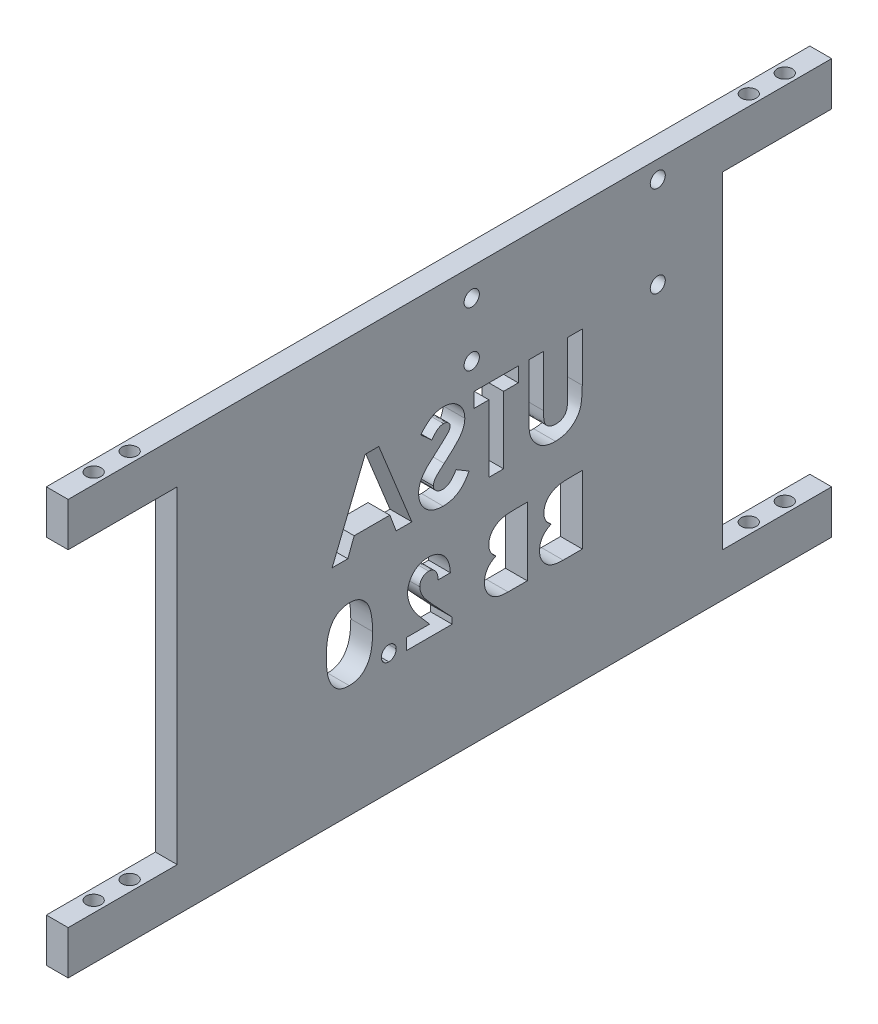
from build123d import *

# Parameters (mm, degrees)
BOSS_EXTRUDE1_DEPTH     = 5.08
CUT_EXTRUDE7_DEPTH      = 22.86
CUT_EXTRUDE8_DEPTH      = 37.084
CUT_EXTRUDE9_DEPTH      = 119.38
CUT_EXTRUDE9_DEPTH_BACK = 119.38
SKETCH10_R              = 1.7526
SKETCH11_R              = 1.7526
CUT_EXTRUDE10_DEPTH     = 12.954
SKETCH12_R              = 1.778
CUT_EXTRUDE11_DEPTH     = 28.194
CUT_EXTRUDE12_DEPTH     = 46.482


with BuildPart() as part:
    # Sketch1 → Boss-Extrude1 (new body)
    with BuildSketch(Plane(origin=(0, 0, 0), x_dir=(0, 0, -1), z_dir=(1, 0, 0))):
        Polygon((62.997029703, 20.37029703), (88.397029703, 20.37029703), (88.397029703, 10.21029703), (-89.402970297, 10.21029703), (-89.402970297, 20.37029703), (-64.002970297, 20.37029703), (-64.002970297, 96.57029703), (-89.402970297, 96.57029703), (-89.402970297, 106.73029703), (88.397029703, 106.73029703), (88.397029703, 96.57029703), (62.997029703, 96.57029703), align=None)
    extrude(amount=BOSS_EXTRUDE1_DEPTH)

    # Sketch6 → Cut-Extrude7 (cut)
    # profile 1 of 4: a face of its own
    with BuildSketch(Plane(origin=(0, 0, 0), x_dir=(0, 0, -1), z_dir=(1, 0, 0))):
        with BuildLine():
            Line((30.31895278, 81.243055873), (26.899722011, 81.243055873))
            Line((26.899722011, 81.243055873), (26.899722011, 68.848344335))
            add(Edge.make_bspline(
                [(26.899722011, 68.848344335), (26.89953609, 68.719841341), (26.899176985, 68.471639138), (26.881200037, 68.115550237), (26.864749889, 67.788229981), (26.835069153, 67.490036714), (26.791220533, 67.220842881), (26.748760761, 66.978919274), (26.691295658, 66.768597264), (26.604934795, 66.529195753), (26.471881056, 66.260215079), (26.254478628, 65.97987725), (26.003614824, 65.724028292), (25.702940107, 65.511069312), (25.365008315, 65.338804693), (24.991676234, 65.211175674), (24.583470129, 65.140230885), (24.301218, 65.129399864), (24.155941963, 65.123825104)],
                knots=[0, 0, 0, 0, 1.155499968, 2.231836252, 3.205919964, 4.102923608, 4.924856345, 5.658536265, 6.31071849, 6.882491295, 7.94666036, 8.992281882, 10.060072772, 11.158554251, 12.289267114, 13.461410017, 14.693379945, 16, 16, 16, 16], degree=3))
            add(Edge.make_bspline(
                [(24.155941963, 65.123825104), (24.001604101, 65.128328794), (23.700671401, 65.137110228), (23.267827619, 65.223309508), (22.8667954, 65.360568282), (22.506065965, 65.556471534), (22.185998296, 65.791295914), (21.915067721, 66.059069295), (21.701250307, 66.36032575), (21.561892071, 66.63825777), (21.483649284, 66.894069992), (21.425002418, 67.122628505), (21.382007777, 67.392304926), (21.343001626, 67.698887677), (21.319561934, 68.045552365), (21.294145409, 68.429511066), (21.284830017, 68.853390929), (21.283242276, 69.148546434), (21.282414318, 69.302460921)],
                knots=[0, 0, 0, 0, 1.261321664, 2.459363699, 3.594844139, 4.716940403, 5.803436589, 6.833651888, 7.818396249, 8.814403945, 9.360733334, 10.004355033, 10.743453831, 11.592799886, 12.532235708, 13.585170094, 14.740740724, 16, 16, 16, 16], degree=3))
            Line((21.282414318, 69.302460921), (21.282414318, 81.243055873))
            Line((21.282414318, 81.243055873), (17.863183549, 81.243055873))
            Line((17.863183549, 81.243055873), (17.863183549, 69.878692892))
            add(Edge.make_bspline(
                [(17.863183549, 69.878692892), (17.863658371, 69.648451442), (17.864571409, 69.205719586), (17.878592905, 68.569482754), (17.908442135, 67.988382465), (17.933512045, 67.462248923), (17.982030906, 66.991790916), (18.032576177, 66.574999455), (18.097000474, 66.213351555), (18.192859954, 65.80165937), (18.358285037, 65.327610896), (18.624971959, 64.781764629), (18.963513746, 64.247348069), (19.363653219, 63.730240169), (19.815447286, 63.249863594), (20.308878705, 62.82815514), (20.836108077, 62.471435263), (21.402644573, 62.188426193), (22.00800604, 61.967700453), (22.658182078, 61.819383873), (23.352729318, 61.71917933), (23.832466225, 61.709553451), (24.079619847, 61.704594335)],
                knots=[0, 0, 0, 0, 1.170808336, 2.251350247, 3.235597562, 4.129743112, 4.929140599, 5.639994148, 6.264258765, 6.79612947, 7.788252245, 8.809469599, 9.879094798, 10.999557536, 12.129761673, 13.226370002, 14.293821979, 15.358369427, 16.438775801, 17.562147481, 18.744053101, 20, 20, 20, 20], degree=3))
            add(Edge.make_bspline(
                [(24.079619847, 61.704594335), (24.243833631, 61.707360299), (24.567824057, 61.71281749), (25.044308816, 61.760935658), (25.504924935, 61.831843745), (25.948806921, 61.935291342), (26.377495403, 62.068926315), (26.790876491, 62.233421661), (27.187413959, 62.427859845), (27.56488884, 62.650452457), (27.922836619, 62.891148048), (28.249982412, 63.157969243), (28.557584074, 63.431183607), (28.836755121, 63.722289159), (29.089592376, 64.028229789), (29.31557512, 64.349698858), (29.51436762, 64.686667812), (29.690970389, 65.045210496), (29.842125124, 65.44355034), (29.969554244, 65.895856458), (30.080879321, 66.409218295), (30.16360955, 66.984792429), (30.238613261, 67.620681831), (30.286086475, 68.318543091), (30.310921851, 69.07839623), (30.316208161, 69.605186659), (30.31895278, 69.878692892)],
                knots=[0, 0, 0, 0, 1.001158378, 1.975264943, 2.917723546, 3.841610987, 4.75185031, 5.653588123, 6.552117133, 7.442167995, 8.324307438, 9.179605724, 10.014504199, 10.831958861, 11.636465792, 12.43274043, 13.225645099, 14.020104002, 14.867201867, 15.819789774, 16.883317127, 18.068162734, 19.364263498, 20.787406516, 22.332041935, 24, 24, 24, 24], degree=3))
            Line((30.31895278, 69.878692892), (30.31895278, 81.243055873))
        make_face()
    # profile 2 of 4: a face of its own
    with BuildSketch(Plane(origin=(0, 0, 0), x_dir=(0, 0, -1), z_dir=(1, 0, 0))):
        Polygon((15.420875857, 81.243055873), (5.163183549, 81.243055873), (5.163183549, 77.823825104), (8.582414318, 77.823825104), (8.582414318, 62.193055873), (12.001645088, 62.193055873), (12.001645088, 77.823825104), (15.420875857, 77.823825104), align=None)
    # profile 3 of 4: a face of its own
    with BuildSketch(Plane(origin=(0, 0, 0), x_dir=(0, 0, -1), z_dir=(1, 0, 0))):
        with BuildLine():
            Line((-7.292585682, 78.697713325), (-4.735794816, 76.358440488))
            add(Edge.make_bspline(
                [(-4.735794816, 76.358440488), (-4.626272859, 76.512932595), (-4.416005974, 76.809535896), (-4.075185285, 77.206694706), (-3.735903576, 77.545500728), (-3.395017609, 77.824538585), (-3.0495059, 78.042112916), (-2.699968206, 78.196157946), (-2.348386155, 78.294085834), (-2.112177289, 78.306280212), (-1.995830874, 78.312286642)],
                knots=[0, 0, 0, 0, 1.299362458, 2.494594718, 3.587462134, 4.587049575, 5.512617175, 6.380583204, 7.202344345, 8, 8, 8, 8], degree=3))
            add(Edge.make_bspline(
                [(-1.995830874, 78.312286642), (-1.887306276, 78.308480692), (-1.677773789, 78.301132403), (-1.379069684, 78.228090953), (-1.113875926, 78.102032137), (-0.882451332, 77.937199631), (-0.69912891, 77.738614675), (-0.552760172, 77.530350117), (-0.470342273, 77.300473144), (-0.459494456, 77.142584367), (-0.454124143, 77.064420056)],
                knots=[0, 0, 0, 0, 1.185010067, 2.2879431, 3.333075148, 4.379039566, 5.372662701, 6.27520591, 7.14612461, 8, 8, 8, 8], degree=3))
            add(Edge.make_bspline(
                [(-0.454124143, 77.064420056), (-0.457489446, 76.985128581), (-0.464266698, 76.825446569), (-0.529725731, 76.591412694), (-0.628391183, 76.362734355), (-0.722670052, 76.223526968), (-0.770860922, 76.152370777)],
                knots=[0, 0, 0, 0, 0.967525499, 1.948461899, 2.951351359, 4, 4, 4, 4], degree=3))
            add(Edge.make_bspline(
                [(-0.770860922, 76.152370777), (-0.814671636, 76.097061814), (-0.915518115, 75.969747887), (-1.107811695, 75.768102471), (-1.349292047, 75.521069187), (-1.649251842, 75.237142784), (-1.995238925, 74.90611216), (-2.403290244, 74.540990253), (-2.861660303, 74.130469664), (-3.187459121, 73.844597991), (-3.358180634, 73.694798662)],
                knots=[0, 0, 0, 0, 0.473873513, 1.090794244, 1.870441696, 2.795289791, 3.865433203, 5.087734844, 6.473946851, 8, 8, 8, 8], degree=3))
            add(Edge.make_bspline(
                [(-3.358180634, 73.694798662), (-3.518427331, 73.556113228), (-3.822542271, 73.292917087), (-4.255237438, 72.919352425), (-4.635504425, 72.583265406), (-4.968882855, 72.289699979), (-5.250319035, 72.03557597), (-5.480996125, 71.819678669), (-5.663731453, 71.6462112), (-5.767605788, 71.541436743), (-5.811936643, 71.496721738)],
                knots=[0, 0, 0, 0, 1.543621617, 2.929473131, 4.163658386, 5.240097082, 6.164993805, 6.925417477, 7.541396219, 8, 8, 8, 8], degree=3))
            add(Edge.make_bspline(
                [(-5.811936643, 71.496721738), (-5.980118667, 71.314712769), (-6.30342358, 70.964827611), (-6.723605995, 70.422615653), (-7.069429714, 69.893306223), (-7.336965501, 69.366939505), (-7.539019287, 68.835921075), (-7.681469883, 68.287227735), (-7.766784493, 67.715125983), (-7.776256407, 67.324736378), (-7.78104722, 67.127280633)],
                knots=[0, 0, 0, 0, 1.206664779, 2.319633467, 3.337109185, 4.282041471, 5.190008762, 6.099243693, 7.03861361, 8, 8, 8, 8], degree=3))
            add(Edge.make_bspline(
                [(-7.78104722, 67.127280633), (-7.777637242, 66.934884225), (-7.770946737, 66.557395311), (-7.689000889, 66.004996516), (-7.572150919, 65.476326894), (-7.391480367, 64.977139119), (-7.171280167, 64.499239175), (-6.895227414, 64.050071225), (-6.571041308, 63.625089504), (-6.199474253, 63.231891081), (-5.78847697, 62.875090766), (-5.347643323, 62.557458698), (-4.872662619, 62.295212966), (-4.367593019, 62.079272313), (-3.832704874, 61.912951934), (-3.268635398, 61.790025673), (-2.674521808, 61.716247268), (-2.268258374, 61.708534612), (-2.060704672, 61.704594335)],
                knots=[0, 0, 0, 0, 1.043214005, 2.046824704, 3.02475056, 3.976699089, 4.921714032, 5.875962561, 6.831408892, 7.817874052, 8.806269674, 9.781291748, 10.760897367, 11.74438705, 12.757449933, 13.795994037, 14.874007457, 16, 16, 16, 16], degree=3))
            add(Edge.make_bspline(
                [(-2.060704672, 61.704594335), (-1.897776783, 61.707484784), (-1.575086124, 61.713209531), (-1.099488878, 61.759947328), (-0.640245974, 61.835377158), (-0.197874707, 61.943490638), (0.229617882, 62.080485081), (0.642249351, 62.247818544), (1.037171168, 62.448084635), (1.417371497, 62.677165085), (1.781002097, 62.943157664), (2.132660932, 63.240624239), (2.468854995, 63.57413998), (2.791198956, 63.942916134), (3.09763037, 64.347996988), (3.398179835, 64.783741041), (3.679490029, 65.258235111), (3.85326785, 65.591096539), (3.942029703, 65.761114767)],
                knots=[0, 0, 0, 0, 1.016823716, 2.013894106, 2.979844003, 3.91962641, 4.853723003, 5.779685073, 6.695824784, 7.614987388, 8.547259901, 9.504950863, 10.487499108, 11.500346958, 12.559593716, 13.656357062, 14.802919212, 16, 16, 16, 16], degree=3))
            Line((3.942029703, 65.761114767), (0.934938357, 67.566132796))
            add(Edge.make_bspline(
                [(0.934938357, 67.566132796), (0.823910545, 67.373139892), (0.61106074, 67.003156002), (0.250366846, 66.506035752), (-0.119145633, 66.080334547), (-0.506019497, 65.733576682), (-0.905550503, 65.46112556), (-1.319668479, 65.266413086), (-1.748664376, 65.145886285), (-2.040876893, 65.131167179), (-2.186636162, 65.123825104)],
                knots=[0, 0, 0, 0, 1.283663364, 2.460892379, 3.537111102, 4.529833553, 5.449777664, 6.316464042, 7.160231139, 8, 8, 8, 8], degree=3))
            add(Edge.make_bspline(
                [(-2.186636162, 65.123825104), (-2.334894208, 65.12982104), (-2.622536408, 65.14145403), (-3.033108841, 65.248904451), (-3.409537193, 65.417609494), (-3.734919081, 65.658328327), (-4.010431948, 65.936154447), (-4.213776259, 66.245248708), (-4.341518526, 66.579681238), (-4.355023981, 66.812000072), (-4.361816451, 66.928843133)],
                knots=[0, 0, 0, 0, 1.13588714, 2.203786484, 3.234766741, 4.283437687, 5.291419208, 6.222934724, 7.106237994, 8, 8, 8, 8], degree=3))
            add(Edge.make_bspline(
                [(-4.361816451, 66.928843133), (-4.355543883, 67.037546587), (-4.342801762, 67.258367249), (-4.248947224, 67.586692063), (-4.102223955, 67.914867563), (-3.928639981, 68.184045987), (-3.751996551, 68.409421784), (-3.583085591, 68.604699717), (-3.377396724, 68.820447646), (-3.135451485, 69.056936966), (-2.860446604, 69.316249552), (-2.552150424, 69.598360011), (-2.207032628, 69.900783288), (-1.963102689, 70.106791036), (-1.835554432, 70.2145102)],
                knots=[0, 0, 0, 0, 0.916159276, 1.861089862, 2.860218735, 3.940849679, 4.552606315, 5.27541173, 6.11797699, 7.06649574, 8.129236253, 9.306560635, 10.591630461, 12, 12, 12, 12], degree=3))
            add(Edge.make_bspline(
                [(-1.835554432, 70.2145102), (-1.593080119, 70.41966672), (-1.12769852, 70.813424179), (-0.470055278, 71.39499155), (0.122540168, 71.938519547), (0.644969527, 72.450727363), (1.103889357, 72.922155708), (1.496191654, 73.356633703), (1.817566798, 73.757512752), (2.15574484, 74.232327158), (2.477081594, 74.810921138), (2.754807737, 75.50703677), (2.934984737, 76.203064075), (2.955171064, 76.670338471), (2.965106626, 76.900327508)],
                knots=[0, 0, 0, 0, 1.345494975, 2.582412109, 3.71882943, 4.751509156, 5.681369928, 6.505683931, 7.230279997, 7.856715994, 8.973648664, 10.023341002, 11.027102913, 12, 12, 12, 12], degree=3))
            add(Edge.make_bspline(
                [(2.965106626, 76.900327508), (2.960974439, 77.063423388), (2.952833586, 77.384739792), (2.880215926, 77.857188747), (2.771686067, 78.313062291), (2.614069552, 78.750697192), (2.409502348, 79.169545292), (2.161063425, 79.57165703), (1.864894996, 79.95333146), (1.531133172, 80.31431556), (1.163413094, 80.644213947), (0.77045746, 80.935382329), (0.354490434, 81.181307379), (-0.081943308, 81.385320065), (-0.541548166, 81.541478816), (-1.02093825, 81.652171922), (-1.520801159, 81.718008652), (-1.86079712, 81.726958391), (-2.033991932, 81.731517412)],
                knots=[0, 0, 0, 0, 1.010766082, 1.991317756, 2.957454644, 3.913069143, 4.869106762, 5.843196583, 6.838735724, 7.860187025, 8.887984031, 9.89767229, 10.887916223, 11.879572884, 12.879850636, 13.892031539, 14.926195476, 16, 16, 16, 16], degree=3))
            add(Edge.make_bspline(
                [(-2.033991932, 81.731517412), (-2.258443836, 81.723306483), (-2.705575899, 81.706949439), (-3.36667355, 81.579042704), (-4.012406096, 81.37789589), (-4.532749483, 81.135234389), (-4.946777003, 80.900168078), (-5.264090422, 80.683748629), (-5.586973906, 80.435828519), (-5.918031309, 80.155626486), (-6.251111073, 79.837863155), (-6.595684247, 79.490103133), (-6.947055602, 79.109340959), (-7.175391272, 78.837326228), (-7.292585682, 78.697713325)],
                knots=[0, 0, 0, 0, 1.282922637, 2.555718331, 3.837320111, 5.142675274, 5.830281639, 6.55870424, 7.337177975, 8.157850921, 9.037902056, 9.96903443, 10.957596896, 12, 12, 12, 12], degree=3))
        make_face()
    # profile 4 of 4: a face of its own
    with BuildSketch(Plane(origin=(0, 0, 0), x_dir=(0, 0, -1), z_dir=(1, 0, 0))):
        Polygon((-17.065632557, 81.243055873), (-20.236816451, 81.243055873), (-27.930085682, 62.193055873), (-24.27807246, 62.193055873), (-22.797423422, 66.100748181), (-14.497393374, 66.100748181), (-13.016744335, 62.193055873), (-9.36854722, 62.193055873), align=None)
        Polygon((-18.649316451, 76.133290248), (-15.794869335, 69.51997895), (-21.503763566, 69.51997895), align=None, mode=Mode.SUBTRACT)
    extrude(amount=CUT_EXTRUDE7_DEPTH, mode=Mode.SUBTRACT)


with BuildPart() as cut_extrude7_piece_1:
    # of the separate pieces the step leaves, piece 1, a body of its own (cut_extrude7_pieces)
    add(part.part.solids().sort_by_distance((0, 20.37029703, -62.997029703))[0])

    # Sketch7 → Cut-Extrude8 (cut)
    # profile 1 of 5: a face of its own
    with BuildSketch(Plane(origin=(0, 0, 0), x_dir=(0, 0, -1), z_dir=(1, 0, 0))):
        with BuildLine():
            Line((30.33932928, 36.846029673), (30.33932928, 52.721029673))
            Line((30.33932928, 52.721029673), (27.795258767, 52.721029673))
            add(Edge.make_bspline(
                [(27.795258767, 52.721029673), (27.617157924, 52.721049999), (27.272536169, 52.721089329), (26.775336914, 52.703629323), (26.314226595, 52.68104285), (25.890672644, 52.655773839), (25.503954142, 52.612230284), (25.154659157, 52.566340134), (24.842089797, 52.510999441), (24.648845147, 52.461357125), (24.55792904, 52.438001829)],
                knots=[0, 0, 0, 0, 1.311965854, 2.538629056, 3.664479157, 4.713267157, 5.663616078, 6.530575999, 7.308677837, 8, 8, 8, 8], degree=3))
            add(Edge.make_bspline(
                [(24.55792904, 52.438001829), (24.438546961, 52.405058767), (24.204280996, 52.340413904), (23.868737375, 52.209860809), (23.550427446, 52.064741789), (23.249739854, 51.899188128), (22.968520943, 51.71120113), (22.707839439, 51.499288874), (22.462073088, 51.271957508), (22.239948491, 51.022871373), (22.039184454, 50.75966573), (21.864756501, 50.482409546), (21.713200966, 50.195342251), (21.591916841, 49.894851292), (21.500531531, 49.582320513), (21.433692697, 49.259084467), (21.390372081, 48.924120356), (21.386278852, 48.696233324), (21.384201075, 48.580554914)],
                knots=[0, 0, 0, 0, 1.099996261, 2.158545794, 3.195537121, 4.207578794, 5.205712374, 6.197378256, 7.190519799, 8.17788031, 9.159561366, 10.129234751, 11.085776129, 12.040971148, 13.00380137, 13.975669004, 14.972423361, 16, 16, 16, 16], degree=3))
            add(Edge.make_bspline(
                [(21.384201075, 48.580554914), (21.389633843, 48.43193852), (21.400327581, 48.139405411), (21.468639902, 47.709727197), (21.596736147, 47.303619527), (21.764346969, 46.913597988), (21.992245284, 46.541117364), (22.281632069, 46.186354758), (22.627820205, 45.838386499), (22.893365616, 45.629803), (23.031486732, 45.521310122)],
                knots=[0, 0, 0, 0, 0.986156485, 1.941127874, 2.875419072, 3.804401753, 4.751181392, 5.761612777, 6.835722519, 8, 8, 8, 8], degree=3))
            add(Edge.make_bspline(
                [(23.031486732, 45.521310122), (22.919560006, 45.464172499), (22.700102661, 45.352141428), (22.388537705, 45.16799579), (22.100062566, 44.97213355), (21.833383808, 44.768495534), (21.594095324, 44.548449232), (21.372316491, 44.324674014), (21.178988725, 44.084348491), (21.00610921, 43.836038322), (20.855845145, 43.576147947), (20.724981714, 43.305116262), (20.614446068, 43.022017364), (20.520841624, 42.728291997), (20.451031405, 42.422929884), (20.405513658, 42.105821813), (20.370662425, 41.778049286), (20.367951327, 41.554778825), (20.36657287, 41.441257037)],
                knots=[0, 0, 0, 0, 1.164658916, 2.283573913, 3.35186032, 4.395461096, 5.390182219, 6.362969632, 7.312859996, 8.245001507, 9.165155236, 10.092416118, 11.032087915, 11.979892451, 12.947605196, 13.931445124, 14.948243989, 16, 16, 16, 16], degree=3))
            add(Edge.make_bspline(
                [(20.36657287, 41.441257037), (20.375518135, 41.224436912), (20.393171579, 40.796543265), (20.522244948, 40.168297118), (20.746017158, 39.572662789), (21.046497092, 39.012007584), (21.416746184, 38.50256155), (21.842426464, 38.056291247), (22.319252308, 37.678533343), (22.759181781, 37.423576064), (23.139686131, 37.252475887), (23.454850775, 37.146690968), (23.793330921, 37.048691979), (24.161326715, 36.979875066), (24.552166893, 36.91688626), (24.969662172, 36.877995666), (25.413032261, 36.851640468), (25.717558004, 36.84793775), (25.87448553, 36.846029673)],
                knots=[0, 0, 0, 0, 1.284142165, 2.534249414, 3.780121997, 5.041676246, 6.291546858, 7.49970053, 8.684500223, 9.883330709, 10.50184324, 11.153274765, 11.851151195, 12.587658647, 13.369265475, 14.195992086, 15.070362669, 16, 16, 16, 16], degree=3))
            Line((25.87448553, 36.846029673), (30.33932928, 36.846029673))
        make_face()
        with BuildLine():
            Line((27.489970306, 49.871670699), (27.489970306, 46.411734801))
            Line((27.489970306, 46.411734801), (26.733109328, 46.411734801))
            add(Edge.make_bspline(
                [(26.733109328, 46.411734801), (26.630245121, 46.412631816), (26.431671995, 46.414363449), (26.144854177, 46.436666278), (25.878159926, 46.47471629), (25.632600756, 46.527805628), (25.405889192, 46.595221347), (25.199473536, 46.676336976), (25.014261357, 46.77530686), (24.799087644, 46.922726869), (24.571633511, 47.139662013), (24.371408196, 47.453069775), (24.253476823, 47.81348751), (24.240342449, 48.067682003), (24.233560049, 48.198944337)],
                knots=[0, 0, 0, 0, 1.065314748, 2.056525647, 2.977365736, 3.853934255, 4.656397591, 5.425096493, 6.14721249, 6.826394842, 8.123232004, 9.372140726, 10.643011755, 12, 12, 12, 12], degree=3))
            add(Edge.make_bspline(
                [(24.233560049, 48.198944337), (24.238987211, 48.321893321), (24.249480409, 48.559610241), (24.368222139, 48.893385968), (24.552651521, 49.189179573), (24.770396329, 49.391626105), (24.975445377, 49.529891119), (25.151020954, 49.620932742), (25.343728335, 49.702432273), (25.557298127, 49.7647488), (25.79051073, 49.811508929), (26.042233299, 49.845848643), (26.312900144, 49.869221713), (26.499850309, 49.87083686), (26.596365538, 49.871670699)],
                knots=[0, 0, 0, 0, 1.347982417, 2.606269829, 3.849316587, 5.153353503, 5.842674298, 6.568177932, 7.326619318, 8.142485038, 9.012069166, 9.942760135, 10.937925643, 12, 12, 12, 12], degree=3))
            Line((26.596365538, 49.871670699), (27.489970306, 49.871670699))
        make_face(mode=Mode.SUBTRACT)
        with BuildLine():
            Line((27.489970306, 43.765901468), (27.489970306, 39.695388648))
            Line((27.489970306, 39.695388648), (26.669507565, 39.695388648))
            add(Edge.make_bspline(
                [(26.669507565, 39.695388648), (26.507301037, 39.696315327), (26.195438745, 39.698096985), (25.748696565, 39.719623647), (25.342496237, 39.758421662), (24.97791404, 39.806857858), (24.654391547, 39.872481327), (24.373022341, 39.955913159), (24.129947808, 40.047702706), (23.926625436, 40.161073694), (23.760522705, 40.293009411), (23.610632406, 40.427850882), (23.488421196, 40.583403259), (23.391725406, 40.752989109), (23.308035371, 40.932395796), (23.257559451, 41.128629088), (23.219128858, 41.335873101), (23.217013919, 41.479219302), (23.215931844, 41.552560122)],
                knots=[0, 0, 0, 0, 1.753078804, 3.370512758, 4.83203934, 6.162291463, 7.344201807, 8.395507345, 9.331626367, 10.147333109, 10.898971645, 11.62040215, 12.321813352, 13.025280112, 13.727906689, 14.453419512, 15.208716525, 16, 16, 16, 16], degree=3))
            add(Edge.make_bspline(
                [(23.215931844, 41.552560122), (23.21831813, 41.636426503), (23.222965972, 41.799775651), (23.260924957, 42.038527864), (23.329908832, 42.261418897), (23.416797389, 42.474148373), (23.537707431, 42.669099836), (23.681404885, 42.853019817), (23.855028093, 43.019680218), (24.050277519, 43.179161282), (24.278016644, 43.318795595), (24.538352317, 43.439953094), (24.832698821, 43.541139376), (25.161967928, 43.62170396), (25.524716146, 43.690078009), (25.923591139, 43.730904864), (26.355270937, 43.76126959), (26.654604735, 43.764322426), (26.809431444, 43.765901468)],
                knots=[0, 0, 0, 0, 0.845221588, 1.646264278, 2.427170338, 3.19324141, 3.95557735, 4.731569926, 5.540061037, 6.376114724, 7.268642756, 8.224665384, 9.265483498, 10.400594375, 11.639216012, 12.983232105, 14.439614077, 16, 16, 16, 16], degree=3))
            Line((26.809431444, 43.765901468), (27.489970306, 43.765901468))
        make_face(mode=Mode.SUBTRACT)
    # profile 2 of 5: a face of its own
    with BuildSketch(Plane(origin=(0, 0, 0), x_dir=(0, 0, -1), z_dir=(1, 0, 0))):
        with BuildLine():
            Line((17.517213896, 36.846029673), (17.517213896, 52.721029673))
            Line((17.517213896, 52.721029673), (14.973143383, 52.721029673))
            add(Edge.make_bspline(
                [(14.973143383, 52.721029673), (14.795042539, 52.721049999), (14.450420784, 52.721089329), (13.95322153, 52.703629323), (13.492111211, 52.68104285), (13.068557259, 52.655773839), (12.681838757, 52.612230284), (12.332543773, 52.566340134), (12.019974413, 52.510999441), (11.826729762, 52.461357125), (11.735813655, 52.438001829)],
                knots=[0, 0, 0, 0, 1.311965854, 2.538629056, 3.664479157, 4.713267157, 5.663616078, 6.530575999, 7.308677837, 8, 8, 8, 8], degree=3))
            add(Edge.make_bspline(
                [(11.735813655, 52.438001829), (11.616431576, 52.405058767), (11.382165611, 52.340413904), (11.046621991, 52.209860809), (10.728312061, 52.064741789), (10.427624469, 51.899188128), (10.146405558, 51.71120113), (9.885724054, 51.499288874), (9.639957703, 51.271957508), (9.417833107, 51.022871373), (9.21706907, 50.75966573), (9.042641116, 50.482409546), (8.891085581, 50.195342251), (8.769801456, 49.894851292), (8.678416147, 49.582320513), (8.611577312, 49.259084467), (8.568256697, 48.924120356), (8.564163467, 48.696233324), (8.56208569, 48.580554914)],
                knots=[0, 0, 0, 0, 1.099996261, 2.158545794, 3.195537121, 4.207578794, 5.205712374, 6.197378256, 7.190519799, 8.17788031, 9.159561366, 10.129234751, 11.085776129, 12.040971148, 13.00380137, 13.975669004, 14.972423361, 16, 16, 16, 16], degree=3))
            add(Edge.make_bspline(
                [(8.56208569, 48.580554914), (8.567518459, 48.43193852), (8.578212196, 48.139405411), (8.646524517, 47.709727197), (8.774620763, 47.303619527), (8.942231584, 46.913597988), (9.1701299, 46.541117364), (9.459516684, 46.186354758), (9.80570482, 45.838386499), (10.071250231, 45.629803), (10.209371347, 45.521310122)],
                knots=[0, 0, 0, 0, 0.986156485, 1.941127874, 2.875419072, 3.804401753, 4.751181392, 5.761612777, 6.835722519, 8, 8, 8, 8], degree=3))
            add(Edge.make_bspline(
                [(10.209371347, 45.521310122), (10.097444621, 45.464172499), (9.877987277, 45.352141428), (9.566422321, 45.16799579), (9.277947181, 44.97213355), (9.011268424, 44.768495534), (8.77197994, 44.548449232), (8.550201107, 44.324674014), (8.35687334, 44.084348491), (8.183993825, 43.836038322), (8.03372976, 43.576147947), (7.902866329, 43.305116262), (7.792330683, 43.022017364), (7.69872624, 42.728291997), (7.628916021, 42.422929884), (7.583398273, 42.105821813), (7.548547041, 41.778049286), (7.545835942, 41.554778825), (7.544457485, 41.441257037)],
                knots=[0, 0, 0, 0, 1.164658916, 2.283573913, 3.35186032, 4.395461096, 5.390182219, 6.362969632, 7.312859996, 8.245001507, 9.165155236, 10.092416118, 11.032087915, 11.979892451, 12.947605196, 13.931445124, 14.948243989, 16, 16, 16, 16], degree=3))
            add(Edge.make_bspline(
                [(7.544457485, 41.441257037), (7.55340275, 41.224436912), (7.571056194, 40.796543265), (7.700129563, 40.168297118), (7.923901773, 39.572662789), (8.224381707, 39.012007584), (8.594630799, 38.50256155), (9.020311079, 38.056291247), (9.497136923, 37.678533343), (9.937066397, 37.423576064), (10.317570746, 37.252475887), (10.63273539, 37.146690968), (10.971215537, 37.048691979), (11.33921133, 36.979875066), (11.730051508, 36.91688626), (12.147546788, 36.877995666), (12.590916877, 36.851640468), (12.89544262, 36.84793775), (13.052370146, 36.846029673)],
                knots=[0, 0, 0, 0, 1.284142165, 2.534249414, 3.780121997, 5.041676246, 6.291546858, 7.49970053, 8.684500223, 9.883330709, 10.50184324, 11.153274765, 11.851151195, 12.587658647, 13.369265475, 14.195992086, 15.070362669, 16, 16, 16, 16], degree=3))
            Line((13.052370146, 36.846029673), (17.517213896, 36.846029673))
        make_face()
        with BuildLine():
            Line((14.667854921, 49.871670699), (14.667854921, 46.411734801))
            Line((14.667854921, 46.411734801), (13.910993944, 46.411734801))
            add(Edge.make_bspline(
                [(13.910993944, 46.411734801), (13.808129737, 46.412631816), (13.609556611, 46.414363449), (13.322738793, 46.436666278), (13.056044542, 46.47471629), (12.810485371, 46.527805628), (12.583773808, 46.595221347), (12.377358151, 46.676336976), (12.192145973, 46.77530686), (11.976972259, 46.922726869), (11.749518127, 47.139662013), (11.549292812, 47.453069775), (11.431361439, 47.81348751), (11.418227064, 48.067682003), (11.411444665, 48.198944337)],
                knots=[0, 0, 0, 0, 1.065314748, 2.056525647, 2.977365736, 3.853934255, 4.656397591, 5.425096493, 6.14721249, 6.826394842, 8.123232004, 9.372140726, 10.643011755, 12, 12, 12, 12], degree=3))
            add(Edge.make_bspline(
                [(11.411444665, 48.198944337), (11.416871826, 48.321893321), (11.427365024, 48.559610241), (11.546106754, 48.893385968), (11.730536136, 49.189179573), (11.948280944, 49.391626105), (12.153329992, 49.529891119), (12.32890557, 49.620932742), (12.52161295, 49.702432273), (12.735182742, 49.7647488), (12.968395345, 49.811508929), (13.220117914, 49.845848643), (13.490784759, 49.869221713), (13.677734924, 49.87083686), (13.774250154, 49.871670699)],
                knots=[0, 0, 0, 0, 1.347982417, 2.606269829, 3.849316587, 5.153353503, 5.842674298, 6.568177932, 7.326619318, 8.142485038, 9.012069166, 9.942760135, 10.937925643, 12, 12, 12, 12], degree=3))
            Line((13.774250154, 49.871670699), (14.667854921, 49.871670699))
        make_face(mode=Mode.SUBTRACT)
        with BuildLine():
            Line((14.667854921, 43.765901468), (14.667854921, 39.695388648))
            Line((14.667854921, 39.695388648), (13.847392181, 39.695388648))
            add(Edge.make_bspline(
                [(13.847392181, 39.695388648), (13.685185652, 39.696315327), (13.373323361, 39.698096985), (12.92658118, 39.719623647), (12.520380853, 39.758421662), (12.155798656, 39.806857858), (11.832276162, 39.872481327), (11.550906956, 39.955913159), (11.307832424, 40.047702706), (11.104510051, 40.161073694), (10.938407321, 40.293009411), (10.788517021, 40.427850882), (10.666305811, 40.583403259), (10.569610021, 40.752989109), (10.485919986, 40.932395796), (10.435444066, 41.128629088), (10.397013473, 41.335873101), (10.394898534, 41.479219302), (10.39381646, 41.552560122)],
                knots=[0, 0, 0, 0, 1.753078804, 3.370512758, 4.83203934, 6.162291463, 7.344201807, 8.395507345, 9.331626367, 10.147333109, 10.898971645, 11.62040215, 12.321813352, 13.025280112, 13.727906689, 14.453419512, 15.208716525, 16, 16, 16, 16], degree=3))
            add(Edge.make_bspline(
                [(10.39381646, 41.552560122), (10.396202745, 41.636426503), (10.400850588, 41.799775651), (10.438809572, 42.038527864), (10.507793447, 42.261418897), (10.594682004, 42.474148373), (10.715592047, 42.669099836), (10.8592895, 42.853019817), (11.032912709, 43.019680218), (11.228162135, 43.179161282), (11.45590126, 43.318795595), (11.716236932, 43.439953094), (12.010583437, 43.541139376), (12.339852543, 43.62170396), (12.702600761, 43.690078009), (13.101475754, 43.730904864), (13.533155553, 43.76126959), (13.83248935, 43.764322426), (13.987316059, 43.765901468)],
                knots=[0, 0, 0, 0, 0.845221588, 1.646264278, 2.427170338, 3.19324141, 3.95557735, 4.731569926, 5.540061037, 6.376114724, 7.268642756, 8.224665384, 9.265483498, 10.400594375, 11.639216012, 12.983232105, 14.439614077, 16, 16, 16, 16], degree=3))
            Line((13.987316059, 43.765901468), (14.667854921, 43.765901468))
        make_face(mode=Mode.SUBTRACT)
    # profile 3 of 5: a face of its own
    with BuildSketch(Plane(origin=(0, 0, 0), x_dir=(0, 0, -1), z_dir=(1, 0, 0))):
        with BuildLine():
            Line((-3.242401489, 47.429363007), (-0.393042515, 47.429363007))
            add(Edge.make_bspline(
                [(-0.393042515, 47.429363007), (-0.405348459, 47.644901939), (-0.429393536, 48.066052071), (-0.525038773, 48.677786123), (-0.653200108, 49.255807534), (-0.824248424, 49.798094321), (-1.039181824, 50.304449435), (-1.29246952, 50.776599067), (-1.590582435, 51.21205734), (-1.927175746, 51.608724228), (-2.296535026, 51.964577754), (-2.690992013, 52.280099846), (-3.116580458, 52.540460735), (-3.565524512, 52.754713642), (-4.037747728, 52.925891759), (-4.537718082, 53.040338183), (-5.061106557, 53.117842422), (-5.419408351, 53.124624354), (-5.60202689, 53.128080955)],
                knots=[0, 0, 0, 0, 1.199038563, 2.342849363, 3.436047546, 4.486744587, 5.497670872, 6.488682221, 7.459191391, 8.424610317, 9.374430501, 10.305433194, 11.225809216, 12.140057399, 13.06607119, 14.010487599, 14.985989317, 16, 16, 16, 16], degree=3))
            add(Edge.make_bspline(
                [(-5.60202689, 53.128080955), (-5.826188555, 53.12108652), (-6.263804658, 53.107431744), (-6.899695566, 52.990951973), (-7.493548148, 52.796121555), (-8.044930729, 52.523892081), (-8.549149292, 52.178053069), (-9.006120224, 51.765696649), (-9.402023995, 51.278171366), (-9.739370752, 50.735762351), (-10.019665588, 50.161427541), (-10.216084534, 49.567541532), (-10.345188593, 48.969863649), (-10.35895834, 48.567417614), (-10.365798925, 48.367489008)],
                knots=[0, 0, 0, 0, 1.075374347, 2.099382735, 3.09057751, 4.06680945, 5.040638231, 6.016817125, 7.011024321, 8.044445721, 9.0776792, 10.070479129, 11.0414456, 12, 12, 12, 12], degree=3))
            add(Edge.make_bspline(
                [(-10.365798925, 48.367489008), (-10.363135562, 48.246558057), (-10.357774872, 48.003153924), (-10.320501275, 47.634823731), (-10.264583515, 47.259636366), (-10.180273161, 46.877913518), (-10.075131237, 46.489548183), (-9.947578886, 46.093378118), (-9.794657406, 45.691649461), (-9.618918746, 45.279840826), (-9.409262079, 44.85661523), (-9.165146032, 44.415628358), (-8.880091214, 43.957271399), (-8.557540725, 43.478956321), (-8.195928016, 42.981437501), (-7.793487814, 42.46621362), (-7.354855283, 41.931469195), (-7.043545437, 41.574022556), (-6.883602411, 41.390375627)],
                knots=[0, 0, 0, 0, 0.728284026, 1.46585585, 2.227944881, 3.01186502, 3.81876927, 4.650621989, 5.517437689, 6.406905708, 7.346299482, 8.360816762, 9.441613733, 10.596154504, 11.834900912, 13.145207542, 14.533280747, 16, 16, 16, 16], degree=3))
            Line((-6.883602411, 41.390375627), (-5.226776489, 39.491863007))
            Line((-5.226776489, 39.491863007), (-10.569324566, 39.491863007))
            Line((-10.569324566, 39.491863007), (-10.569324566, 36.846029673))
            Line((-10.569324566, 36.846029673), (0.014008767, 36.846029673))
            Line((0.014008767, 36.846029673), (0.014008767, 38.289789689))
            Line((0.014008767, 38.289789689), (-4.686161505, 43.292068335))
            add(Edge.make_bspline(
                [(-4.686161505, 43.292068335), (-4.822243513, 43.437986356), (-5.085794006, 43.720586291), (-5.460799198, 44.135614361), (-5.80014577, 44.529466092), (-6.096797096, 44.906335211), (-6.366321055, 45.253997619), (-6.596699596, 45.582932292), (-6.7900405, 45.890165545), (-6.999939474, 46.260635189), (-7.1992745, 46.702486165), (-7.382176451, 47.211516606), (-7.493667848, 47.698032475), (-7.509057186, 48.015056673), (-7.516439951, 48.167143455)],
                knots=[0, 0, 0, 0, 1.246127091, 2.413378631, 3.493388633, 4.492180848, 5.408488754, 6.240484944, 6.999099869, 7.674939598, 8.898438119, 10.020720584, 11.050475521, 12, 12, 12, 12], degree=3))
            add(Edge.make_bspline(
                [(-7.516439951, 48.167143455), (-7.510920036, 48.314275683), (-7.500224317, 48.599367965), (-7.382687026, 49.004910217), (-7.20059418, 49.372087327), (-6.943999642, 49.68992763), (-6.633183292, 49.951118083), (-6.274005803, 50.145384204), (-5.869395529, 50.257474865), (-5.585756017, 50.271504612), (-5.439842395, 50.278721981)],
                knots=[0, 0, 0, 0, 1.062038974, 2.057870785, 3.028805853, 4.01125022, 4.991535629, 5.949134679, 6.94496649, 8, 8, 8, 8], degree=3))
            add(Edge.make_bspline(
                [(-5.439842395, 50.278721981), (-5.364461558, 50.276055798), (-5.216062277, 50.270806989), (-4.997926932, 50.235867089), (-4.790355479, 50.174289163), (-4.591037533, 50.091783408), (-4.402100268, 49.982421438), (-4.224020242, 49.847615387), (-4.054921158, 49.690790982), (-3.895578572, 49.512438593), (-3.750556017, 49.313397274), (-3.621747514, 49.095484861), (-3.515244325, 48.858836618), (-3.421475047, 48.606576665), (-3.349155693, 48.335995523), (-3.296498231, 48.04871259), (-3.25646628, 47.745195238), (-3.247175041, 47.536555599), (-3.242401489, 47.429363007)],
                knots=[0, 0, 0, 0, 0.903469896, 1.778625579, 2.63899355, 3.493148037, 4.358286772, 5.247621495, 6.164656832, 7.118446693, 8.109501108, 9.111810964, 10.146451449, 11.215617525, 12.33435995, 13.498009769, 14.714554818, 16, 16, 16, 16], degree=3))
        make_face()
    # profile 4 of 5: a face of its own
    with BuildSketch(Plane(origin=(0, 0, 0), x_dir=(0, 0, -1), z_dir=(1, 0, 0))):
        with BuildLine():
            add(Edge.make_bspline(
                [(-14.741600207, 40.10243993), (-14.85662545, 40.096133372), (-15.083090289, 40.083716849), (-15.410301102, 39.991053637), (-15.705610746, 39.824570975), (-15.969657025, 39.607423197), (-16.192927909, 39.346165427), (-16.354303055, 39.048232884), (-16.454795406, 38.722282859), (-16.465889832, 38.495105535), (-16.471568156, 38.378832157)],
                knots=[0, 0, 0, 0, 1.016957001, 2.002212695, 2.9757545, 3.99499976, 5.013036768, 5.994806404, 6.97370641, 8, 8, 8, 8], degree=3))
            add(Edge.make_bspline(
                [(-16.471568156, 38.378832157), (-16.465927031, 38.262540106), (-16.454905284, 38.035326296), (-16.353607658, 37.708741133), (-16.193169055, 37.408359857), (-15.969639111, 37.144302539), (-15.706704253, 36.923062407), (-15.409622134, 36.758114959), (-15.083713619, 36.660195198), (-14.856735164, 36.648457823), (-14.741600207, 36.642504032)],
                knots=[0, 0, 0, 0, 1.023218912, 1.999186227, 2.986238111, 4.008388923, 5.030539734, 6.0011649, 6.986089706, 8, 8, 8, 8], degree=3))
            add(Edge.make_bspline(
                [(-14.741600207, 36.642504032), (-14.626437969, 36.648409409), (-14.399405732, 36.66005134), (-14.072990615, 36.758940326), (-13.773715205, 36.921961155), (-13.510714283, 37.144570903), (-13.286185707, 37.407424807), (-13.130308522, 37.70968889), (-13.028067337, 38.035203169), (-13.017196265, 38.262498422), (-13.011632258, 38.378832157)],
                knots=[0, 0, 0, 0, 1.013427518, 1.99788335, 2.976245624, 3.997909735, 5.019573847, 6.001765691, 6.977268297, 8, 8, 8, 8], degree=3))
            add(Edge.make_bspline(
                [(-13.011632258, 38.378832157), (-13.017232973, 38.495147944), (-13.028175766, 38.722408128), (-13.129615105, 39.04727421), (-13.286435528, 39.347105557), (-13.510695558, 39.607154275), (-13.774814345, 39.825663631), (-14.072307837, 39.990239578), (-14.400028747, 40.083861771), (-14.626547553, 40.096182186), (-14.741600207, 40.10243993)],
                knots=[0, 0, 0, 0, 1.025808215, 2.00424526, 2.981110158, 3.998665696, 5.017428914, 5.998734231, 6.983523959, 8, 8, 8, 8], degree=3))
        make_face()
    # profile 5 of 5: a face of its own
    with BuildSketch(Plane(origin=(0, 0, 0), x_dir=(0, 0, -1), z_dir=(1, 0, 0))):
        with BuildLine():
            add(Edge.make_bspline(
                [(-23.852552731, 53.128080955), (-23.990473532, 53.126033482), (-24.261662676, 53.122007603), (-24.661073237, 53.078404051), (-25.045816038, 53.012531245), (-25.417396239, 52.920661651), (-25.77313917, 52.799075515), (-26.115634, 52.653538995), (-26.44080405, 52.4764184), (-26.752796277, 52.276351592), (-27.051490501, 52.049847602), (-27.329707816, 51.79162136), (-27.592529061, 51.50761466), (-27.834265124, 51.193533831), (-28.060269323, 50.852235771), (-28.269799047, 50.483666362), (-28.461250294, 50.086021703), (-28.636768775, 49.658584212), (-28.793717955, 49.194946787), (-28.925916055, 48.689791304), (-29.039298047, 48.143002403), (-29.135000448, 47.553219043), (-29.207335995, 46.919657262), (-29.256091609, 46.242737966), (-29.28955002, 45.523766156), (-29.292280662, 45.030557402), (-29.29368354, 44.777169497)],
                knots=[0, 0, 0, 0, 0.879237366, 1.728815576, 2.559023295, 3.367336655, 4.166867292, 4.954216142, 5.737608147, 6.525189134, 7.316157332, 8.124696809, 8.942788509, 9.781158001, 10.649253743, 11.551476218, 12.482711956, 13.461909668, 14.496590415, 15.601789533, 16.789733467, 18.056700938, 19.410929216, 20.8549011, 22.384193279, 24, 24, 24, 24], degree=3))
            add(Edge.make_bspline(
                [(-29.29368354, 44.777169497), (-29.292167408, 44.520611425), (-29.289221591, 44.022123693), (-29.257482485, 43.296575801), (-29.202826246, 42.614741665), (-29.13238134, 41.976691823), (-29.035891088, 41.382763221), (-28.92288759, 40.831417983), (-28.788602783, 40.322855957), (-28.626483748, 39.858223042), (-28.452027684, 39.430034878), (-28.260052736, 39.033165531), (-28.053904999, 38.66654006), (-27.838312883, 38.324627421), (-27.601456834, 38.017507026), (-27.354865303, 37.734735173), (-27.087801255, 37.487083007), (-26.811509118, 37.261787646), (-26.515867196, 37.067087242), (-26.203924363, 36.896805478), (-25.870119223, 36.758686743), (-25.520536474, 36.638558445), (-25.149217408, 36.552319288), (-24.762062234, 36.483891352), (-24.354700048, 36.446073877), (-24.077351464, 36.44138237), (-23.935235023, 36.438978391)],
                knots=[0, 0, 0, 0, 1.643780988, 3.193836972, 4.651895693, 6.025988579, 7.305620092, 8.505800249, 9.631074763, 10.672816429, 11.65661981, 12.592235626, 13.49536222, 14.350718032, 15.179365177, 15.97804903, 16.751647189, 17.51006938, 18.259804725, 19.016521909, 19.783502495, 20.571750527, 21.382245291, 22.22305063, 23.089471752, 24, 24, 24, 24], degree=3))
            add(Edge.make_bspline(
                [(-23.935235023, 36.438978391), (-23.793122418, 36.441428741), (-23.514725914, 36.446228942), (-23.10626218, 36.483610163), (-22.717055278, 36.552596491), (-22.342798482, 36.639220525), (-21.986096559, 36.758420947), (-21.645239135, 36.900672096), (-21.322847109, 37.069891386), (-21.018027828, 37.265045424), (-20.731822031, 37.488833389), (-20.459782083, 37.738861617), (-20.202509751, 38.014496352), (-19.963918785, 38.31882493), (-19.740101756, 38.647785199), (-19.533392722, 39.005133726), (-19.343915909, 39.39035022), (-19.165744447, 39.803971633), (-19.010936, 40.254902759), (-18.87316367, 40.747170358), (-18.760304202, 41.284877884), (-18.669535065, 41.867852593), (-18.597065039, 42.494859429), (-18.543155668, 43.16620103), (-18.511240267, 43.882190089), (-18.508325342, 44.374325035), (-18.506824566, 44.627705354)],
                knots=[0, 0, 0, 0, 0.917216111, 1.796812873, 2.643793957, 3.46689424, 4.273913431, 5.068098542, 5.848489301, 6.620921603, 7.401012384, 8.190319798, 9.003608147, 9.831726257, 10.68377682, 11.569763213, 12.493818149, 13.453288342, 14.474581811, 15.568529029, 16.750744269, 18.018426408, 19.375425659, 20.823733699, 22.36466933, 24, 24, 24, 24], degree=3))
            add(Edge.make_bspline(
                [(-18.506824566, 44.627705354), (-18.509543082, 44.979757361), (-18.514788493, 45.659046243), (-18.5812622, 46.640421175), (-18.678828742, 47.547532301), (-18.82213088, 48.378862247), (-18.999321991, 49.137490017), (-19.226224436, 49.818418168), (-19.484536364, 50.431068869), (-19.704651312, 50.794006833), (-19.810660704, 50.968801107)],
                knots=[0, 0, 0, 0, 1.288568992, 2.486310467, 3.599230591, 4.627010532, 5.572937695, 6.447898582, 7.252493626, 8, 8, 8, 8], degree=3))
            add(Edge.make_bspline(
                [(-19.810660704, 50.968801107), (-19.933923375, 51.140518948), (-20.174926185, 51.476261163), (-20.596326336, 51.917027933), (-21.049065932, 52.293993258), (-21.542443987, 52.598626076), (-22.068657522, 52.83885954), (-22.632224346, 53.008533731), (-23.231063303, 53.107393821), (-23.642296004, 53.121082269), (-23.852552731, 53.128080955)],
                knots=[0, 0, 0, 0, 1.058512271, 2.069600068, 3.047294572, 4.004278952, 4.967380941, 5.939006123, 6.946246673, 8, 8, 8, 8], degree=3))
        make_face()
        with BuildLine():
            add(Edge.make_bspline(
                [(-23.92251467, 50.278721981), (-23.797833123, 50.272812323), (-23.553391105, 50.261226258), (-23.19869409, 50.162876907), (-22.864236951, 50.010971031), (-22.609824339, 49.82817606), (-22.419399029, 49.652945159), (-22.286347499, 49.494366893), (-22.158040269, 49.317404977), (-22.044712862, 49.114074029), (-21.937702207, 48.891679971), (-21.833120542, 48.649213267), (-21.747391038, 48.38071841), (-21.663164074, 48.090767902), (-21.589373394, 47.771345382), (-21.527552981, 47.419839924), (-21.472321876, 47.033965654), (-21.433797521, 46.613469825), (-21.397881262, 46.15879238), (-21.372134786, 45.668920472), (-21.361370831, 45.14398626), (-21.357949297, 44.782471858), (-21.35618354, 44.595904473)],
                knots=[0, 0, 0, 0, 1.076674018, 2.110852608, 3.161083442, 4.239746716, 4.804137807, 5.395870207, 6.026861976, 6.692161227, 7.405688833, 8.16177676, 8.973626916, 9.841385931, 10.773283133, 11.807421078, 12.927755683, 14.143907515, 15.458935494, 16.872852025, 18.386167141, 20, 20, 20, 20], degree=3))
            add(Edge.make_bspline(
                [(-21.35618354, 44.595904473), (-21.359089762, 44.354197406), (-21.364662658, 43.890706185), (-21.393850883, 43.224189671), (-21.452356257, 42.617605973), (-21.52512513, 42.066844049), (-21.627331983, 41.575475739), (-21.744927584, 41.138852242), (-21.890147694, 40.762539447), (-22.057977514, 40.441095026), (-22.243856601, 40.167642924), (-22.445636527, 39.935207406), (-22.656447408, 39.733929214), (-22.882869337, 39.570433418), (-23.12436214, 39.445137778), (-23.378909796, 39.35501417), (-23.646674065, 39.299845757), (-23.830036277, 39.292195672), (-23.92251467, 39.288337365)],
                knots=[0, 0, 0, 0, 1.771748488, 3.397459088, 4.888034009, 6.237357457, 7.467047327, 8.564189669, 9.548206622, 10.417051504, 11.216568818, 11.965764335, 12.669334354, 13.348544111, 14.005342236, 14.656555988, 15.322436492, 16, 16, 16, 16], degree=3))
            add(Edge.make_bspline(
                [(-23.92251467, 39.288337365), (-24.011819498, 39.290977505), (-24.186667246, 39.296146571), (-24.441634422, 39.349206335), (-24.6827495, 39.435469988), (-24.909284479, 39.55749598), (-25.122049644, 39.7126707), (-25.320005129, 39.90167605), (-25.501657993, 40.126395975), (-25.607489777, 40.293171394), (-25.662022883, 40.379107598)],
                knots=[0, 0, 0, 0, 0.992283464, 1.942767638, 2.88273346, 3.832339453, 4.79467288, 5.803907806, 6.868395428, 8, 8, 8, 8], degree=3))
            add(Edge.make_bspline(
                [(-25.662022883, 40.379107598), (-25.726226432, 40.496536674), (-25.860856067, 40.742775924), (-26.016649713, 41.158295476), (-26.147788122, 41.626932855), (-26.260657032, 42.150146504), (-26.337852481, 42.730000044), (-26.404333108, 43.362816572), (-26.436398367, 44.051782697), (-26.441613956, 44.529100914), (-26.444324566, 44.777169497)],
                knots=[0, 0, 0, 0, 0.710965849, 1.490837728, 2.352621235, 3.297892224, 4.334225155, 5.461620853, 6.680770821, 8, 8, 8, 8], degree=3))
            add(Edge.make_bspline(
                [(-26.444324566, 44.777169497), (-26.443277516, 45.027391435), (-26.441262123, 45.509025951), (-26.404285497, 46.200468958), (-26.35279272, 46.831987389), (-26.277473653, 47.402171321), (-26.180561983, 47.912404911), (-26.061117984, 48.362654804), (-25.920302395, 48.753808357), (-25.753311887, 49.085475535), (-25.568359525, 49.367347139), (-25.372026946, 49.609171111), (-25.163483976, 49.815634318), (-24.943079368, 49.987513716), (-24.70571178, 50.118842467), (-24.455915241, 50.211571429), (-24.193177651, 50.267669342), (-24.013953419, 50.27498804), (-23.92251467, 50.278721981)],
                knots=[0, 0, 0, 0, 1.793836731, 3.452829483, 4.963243077, 6.335886805, 7.574563692, 8.684454726, 9.672768357, 10.54971625, 11.340229787, 12.085688095, 12.778991901, 13.440269426, 14.083255152, 14.715733572, 15.344777694, 16, 16, 16, 16], degree=3))
        make_face(mode=Mode.SUBTRACT)
    extrude(amount=CUT_EXTRUDE8_DEPTH, mode=Mode.SUBTRACT)


with BuildPart() as cut_extrude7_piece_2:
    # of the separate pieces the step leaves, piece 2, a body of its own (cut_extrude7_pieces)
    add(part.part.solids().sort_by_distance((0, 69.51997895, 21.503763566))[0])


with BuildPart() as cut_extrude8_piece_1:
    # of the separate pieces the step leaves, piece 1, a body of its own (cut_extrude8_pieces)
    add(cut_extrude7_piece_1.part.solids().sort_by_distance((0, 20.37029703, -62.997029703))[0])

    # Sketch10 → Cut-Extrude9 (cut, two sides: drawn at the far end of the back side and taken through both)
    with BuildSketch(Plane(origin=(0, 0, 0), x_dir=(1, 0, 0), z_dir=(0, 1, 0)).offset(-CUT_EXTRUDE9_DEPTH_BACK)):
        with Locations(Location((2.54, 80.015029703, 0), (0, 0, 90))):
            Circle(SKETCH10_R)
        with Locations(Location((2.54, 71.633029703, 0), (0, 0, 90))):
            Circle(SKETCH10_R)
        with Locations(Location((2.54, -80.923277989, 0), (0, 0, 90))):
            Circle(SKETCH10_R)
        with Locations(Location((2.54, -72.541277989, 0), (0, 0, 90))):
            Circle(SKETCH10_R)
    extrude(amount=CUT_EXTRUDE9_DEPTH + CUT_EXTRUDE9_DEPTH_BACK, mode=Mode.SUBTRACT)

    # Sketch11 → Cut-Extrude10 (cut)
    with BuildSketch(Plane(origin=(0, 0, 0), x_dir=(0, 0, -1), z_dir=(1, 0, 0))):
        with Locations(Location((47.900441752, 102.582452126, 0), (0, 0, 180))):
            Circle(SKETCH11_R)
        with Locations(Location((47.900441752, 81.41661041, 0), (0, 0, 180))):
            Circle(SKETCH11_R)
    extrude(amount=CUT_EXTRUDE10_DEPTH, mode=Mode.SUBTRACT)

    # Sketch12 → Cut-Extrude11 (cut)
    with BuildSketch(Plane(origin=(0, 0, 0), x_dir=(0, 0, -1), z_dir=(1, 0, 0))):
        with Locations(Location((4.577029703, 100.307529538, 0), (0, 0, 180))):
            Circle(SKETCH12_R)
        with Locations(Location((4.577029703, 87.607529538, 0), (0, 0, 180))):
            Circle(SKETCH12_R)
    extrude(amount=CUT_EXTRUDE11_DEPTH, mode=Mode.SUBTRACT)


with BuildPart() as cut_extrude8_piece_2:
    # of the separate pieces the step leaves, piece 2, a body of its own (cut_extrude8_pieces)
    add(cut_extrude7_piece_1.part.solids().sort_by_distance((0, 44.777169497, 26.444324566))[0])


with BuildPart() as cut_extrude8_piece_3:
    # of the separate pieces the step leaves, piece 3, a body of its own (cut_extrude8_pieces)
    add(cut_extrude7_piece_1.part.solids().sort_by_distance((0, 43.765901468, -26.809431444))[0])


with BuildPart() as cut_extrude8_piece_4:
    # of the separate pieces the step leaves, piece 4, a body of its own (cut_extrude8_pieces)
    add(cut_extrude7_piece_1.part.solids().sort_by_distance((0, 43.765901468, -13.987316059))[0])


with BuildPart() as cut_extrude8_piece_5:
    # of the separate pieces the step leaves, piece 5, a body of its own (cut_extrude8_pieces)
    add(cut_extrude7_piece_1.part.solids().sort_by_distance((0, 49.871670699, -26.596365538))[0])


with BuildPart() as cut_extrude8_piece_6:
    # of the separate pieces the step leaves, piece 6, a body of its own (cut_extrude8_pieces)
    add(cut_extrude7_piece_1.part.solids().sort_by_distance((0, 49.871670699, -13.774250154))[0])


with BuildPart() as cut_extrude12_tool:
    # Sketch13 → Cut-Extrude12 (new body)
    with BuildSketch(Plane(origin=(0, 0, 0), x_dir=(0, 0, -1), z_dir=(1, 0, 0))):
        Polygon((-18.851442632, 77.14711992), (-22.522255855, 69.486292324), (-17.554751339, 67.106029743), (-14.542227109, 68.296161034), (-14.542227109, 73.316706122), align=None)
        Polygon((15.692421543, 50.37371956), (15.692421543, 45.185797842), (15.692421543, 38.208937601), (11.756756791, 38.208937601), (8.894455154, 40.355663829), (8.894455154, 43.754647024), (12.517055664, 45.185797842), (10.325605972, 48.316440258), (11.421330818, 51.268188822), align=None)
        Polygon((23.384857193, 50.37371956), (24.189879529, 45.811926325), (21.372301354, 42.055155426), (23.313299652, 39.282300715), (27.899576931, 38.321823798), (28.662225837, 48.092822943), (28.662225837, 50.37371956), align=None)
        Polygon((-27.242103019, 49.79231454), (-27.242103019, 42.055155426), (-24.549750542, 38.208937601), (-20.430359403, 38.935888978), (-20.430359403, 47.779758701), (-22.490054972, 50.722180943), (-25.895926781, 51.435452526), align=None)
    extrude(amount=CUT_EXTRUDE12_DEPTH)


with BuildPart() as cut_extrude7_piece_2_1:
    add(cut_extrude7_piece_2.part)

    # Cut-Extrude12: cut by cut_extrude12_tool
    add(cut_extrude12_tool.part, mode=Mode.SUBTRACT)


with BuildPart() as cut_extrude8_piece_2_1:
    add(cut_extrude8_piece_2.part)

    # Cut-Extrude12: cut by cut_extrude12_tool
    add(cut_extrude12_tool.part, mode=Mode.SUBTRACT)


with BuildPart() as cut_extrude8_piece_3_1:
    add(cut_extrude8_piece_3.part)

    # Cut-Extrude12: cut by cut_extrude12_tool
    add(cut_extrude12_tool.part, mode=Mode.SUBTRACT)


with BuildPart() as cut_extrude8_piece_4_1:
    add(cut_extrude8_piece_4.part)

    # Cut-Extrude12: cut by cut_extrude12_tool
    add(cut_extrude12_tool.part, mode=Mode.SUBTRACT)


with BuildPart() as cut_extrude8_piece_5_1:
    add(cut_extrude8_piece_5.part)

    # Cut-Extrude12: cut by cut_extrude12_tool
    add(cut_extrude12_tool.part, mode=Mode.SUBTRACT)


with BuildPart() as cut_extrude8_piece_6_1:
    add(cut_extrude8_piece_6.part)

    # Cut-Extrude12: cut by cut_extrude12_tool
    add(cut_extrude12_tool.part, mode=Mode.SUBTRACT)


solid = cut_extrude8_piece_1.part
